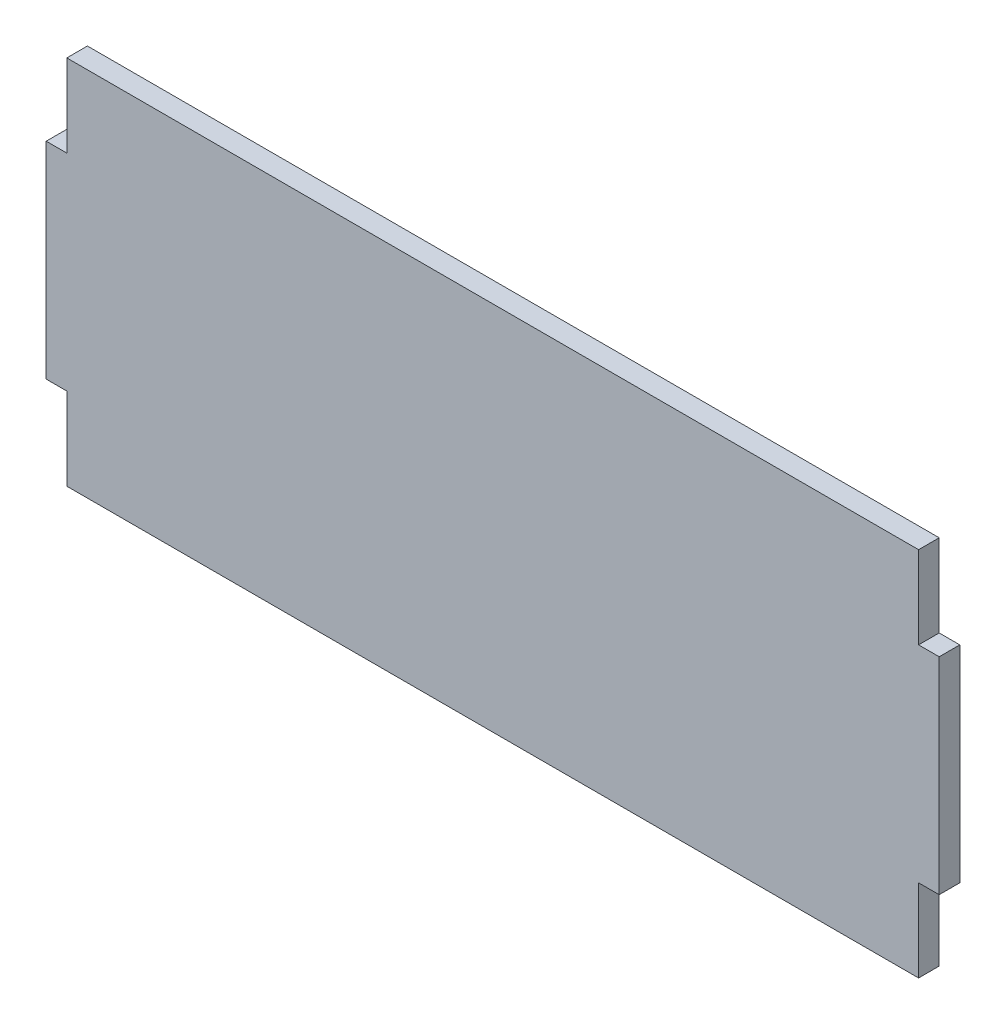
from build123d import *

# Parameters (mm, degrees)
BOSS_EXTRUDE1_DEPTH = 3


with BuildPart() as part:
    # Sketch1 → Boss-Extrude1 (new body)
    with BuildSketch(Plane.XY):
        Polygon((0, 0), (0, 12), (-3, 12), (-3, 42), (0, 42), (0, 54), (124, 54), (124, 42), (127, 42), (127, 12), (124, 12), (124, 0), align=None)
    extrude(amount=BOSS_EXTRUDE1_DEPTH)


solid = part.part
